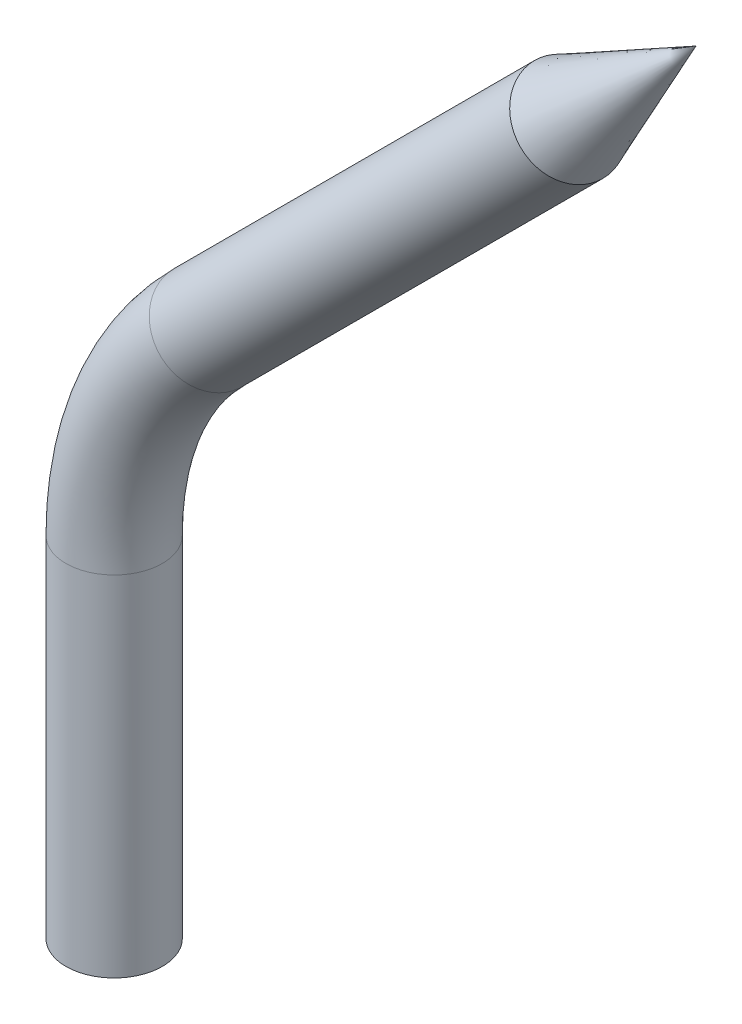
from build123d import *

# Parameters (mm, degrees)
SKETCH8_R               = 0.3
CUT_EXTRUDE1_DEPTH      = 29.849717382
CUT_EXTRUDE1_DEPTH_BACK = 29.849717382
SKETCH10_W              = 5
SKETCH10_H              = 44


with BuildPart() as part:
    # Sweep1: sweep along a path in Sketch7
    with BuildLine(Plane.XY) as sweep1_path:
        Line((0, 0), (0, 24.171572875))
        ThreePointArc((0, 24.171572875), (0.152240935, 24.93693974), (0.585786438, 25.585786438))
        Line((0.585786438, 25.585786438), (2.828427125, 27.828427125))
    # Sketch8 → Sweep1 (sweep)
    with BuildSketch(Plane(origin=(0, 0, 0), x_dir=(1, 0, 0), z_dir=(0, 1, 0))):
        Circle(SKETCH8_R)
    sweep(path=sweep1_path.line)

    # Sketch9 → Revolve2 (revolve)
    with BuildSketch(Plane.XY):
        Polygon((2.61629509, 28.040559159), (3.620114655, 28.620114655), (2.828427125, 27.828427125), align=None)
    revolve(axis=Axis((2.285405043, 27.285405043, 0), (0.7071067811865509, 0.7071067811865442, 0)))

    # Sketch10 → Cut-Extrude1 (cut, two sides: drawn at the far end of the back side and taken through both)
    with BuildSketch(Plane.XY.offset(-CUT_EXTRUDE1_DEPTH_BACK)):
        Rectangle(SKETCH10_W, SKETCH10_H)
    extrude(amount=CUT_EXTRUDE1_DEPTH + CUT_EXTRUDE1_DEPTH_BACK, mode=Mode.SUBTRACT)


solid = part.part
